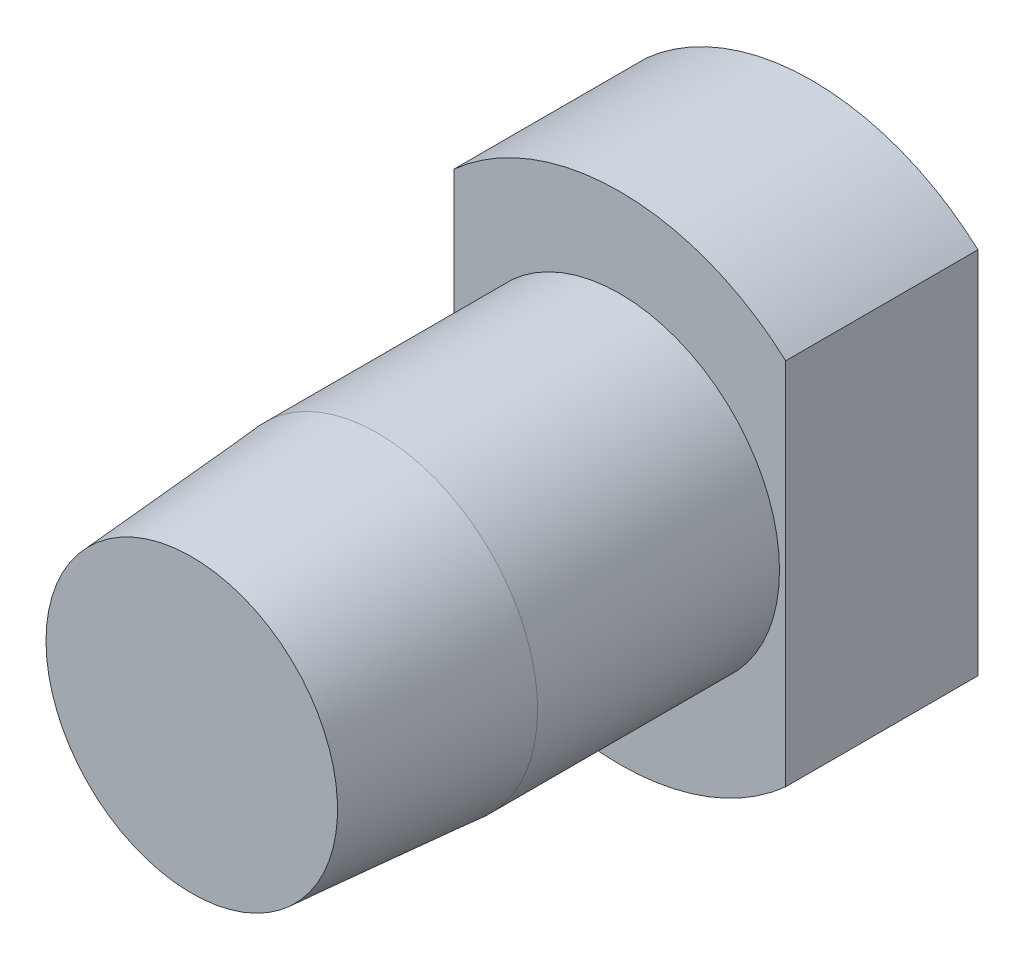
from build123d import *

# Parameters (mm, degrees)
SKETCH2_W          = 2.584728437
SKETCH2_H          = 8.43239663
CUT_EXTRUDE1_DEPTH = 12.489125293


with BuildPart() as part:
    # Sketch1 → Revolve1 (revolve)
    with BuildSketch(Plane(origin=(0, 0, 0), x_dir=(0, 0, -1), z_dir=(1, 0, 0)), mode=Mode.PRIVATE) as revolve1_sk:
        Polygon((0, 0), (0, 2.35), (3, 2.575), (6.9, 2.575), (6.9, 4), (10, 4), (10, 2.25), (7.75, 0), align=None)
    revolve(revolve1_sk.sketch.rotate(Axis((0, 0, 0), (0, 0, -1)), 90), axis=Axis((0, 0, 0), (0, 0, -1)))

    # Sketch2 → Cut-Extrude1 (cut, through all)
    with BuildSketch(Plane(origin=(0, 0, -10), x_dir=(-1, 0, 0), z_dir=(0, 0, -1))):
        with Locations((3.967364219, 0)):
            Rectangle(SKETCH2_W, SKETCH2_H)
        with Locations((-3.967364219, 0)):
            Rectangle(SKETCH2_W, SKETCH2_H)
    extrude(amount=-CUT_EXTRUDE1_DEPTH, mode=Mode.SUBTRACT)


solid = part.part
